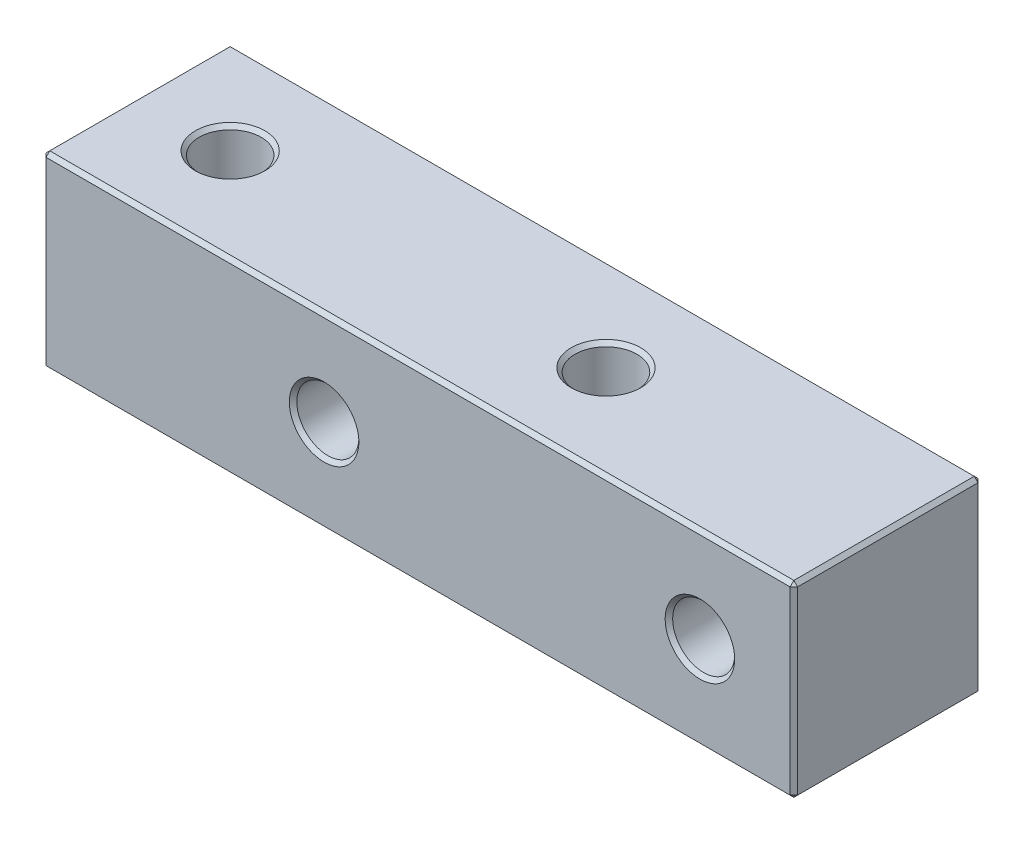
from build123d import *

# Parameters (mm, degrees)
SKETCH_1_W         = 40
SKETCH_1_H         = 10
EXTRUDE_1_DEPTH    = 5
HOLE_WIZARD_M4_1_D = 3.3
HOLE_WIZARD_M4_2_D = 3.3
CHAMFER_1_SIZE     = 0.2


with BuildPart() as part:
    # 草图1 → 凸台-拉伸1 (new, symmetric)
    with BuildSketch(Plane(origin=(0, 0, 0), x_dir=(1, 0, 0), z_dir=(0, 1, 0))):
        Rectangle(SKETCH_1_W, SKETCH_1_H)
    extrude(amount=EXTRUDE_1_DEPTH, both=True)

    # M4 螺纹孔1 (through all)
    with Locations(Plane(origin=(0, 5, 0), x_dir=(1, 0, 0), z_dir=(0, 1, 0))):
        with Locations((-15, 0), (5, 0)):
            Hole(HOLE_WIZARD_M4_1_D / 2)

    # M4 螺纹孔2 (through all)
    with Locations(Plane(origin=(0, 0, -5), x_dir=(-1, 0, 0), z_dir=(0, 0, -1))):
        with Locations((-15, 0), (5, 0)):
            Hole(HOLE_WIZARD_M4_2_D / 2)

    # 倒角1
    chamfer_1_edges = [part.edges().sort_by_distance(p)[0] for p in [
        (-20, 5, 0),
        (6.65, 5, 0),
        (6.65, -5, 0),
        (0, 5, 5),
        (-13.35, 5, 0),
        (-13.35, -5, 0),
        (-6.65, 0, -5),
        (-6.65, 0, 5),
        (13.35, 0, -5),
        (13.35, 0, 5),
        (20, 5, 0),
        (0, -5, 5),
        (-20, -5, 0),
        (0, -5, -5),
        (20, -5, 0),
        (20, 0, 5),
        (-20, 0, 5),
        (-20, 0, -5),
        (20, 0, -5),
        (0, 5, -5),
    ]]
    chamfer(chamfer_1_edges, length=CHAMFER_1_SIZE)


solid = part.part
